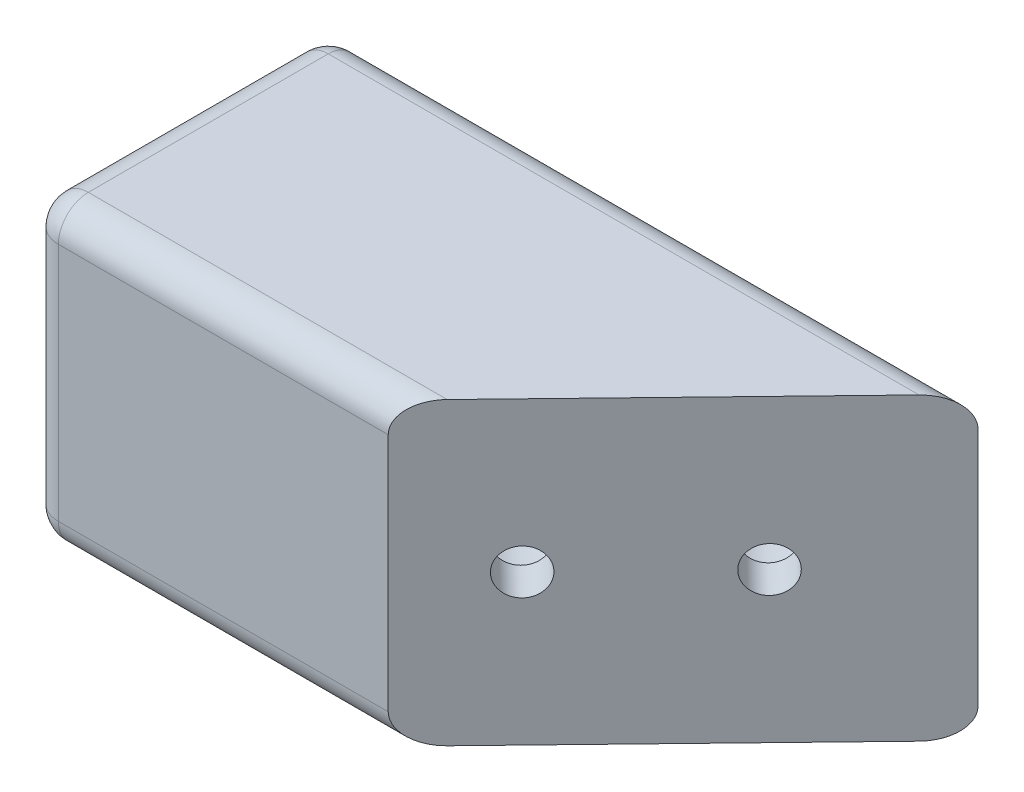
from build123d import *

# Parameters (mm, degrees)
BOSS_EXTRUDE1_DEPTH = 30
SKETCH2_R           = 2.25
CUT_EXTRUDE1_DEPTH  = 57.77507973
SKETCH3_R           = 5
CUT_EXTRUDE2_DEPTH  = 54.530698882
FILLET1_R           = 3


with BuildPart() as part:
    # Sketch1 → Boss-Extrude1 (new body)
    with BuildSketch(Plane(origin=(0, 0, 0), x_dir=(1, 0, 0), z_dir=(0, 1, 0))):
        Polygon((3.5, -15), (32.5, 15), (-32.5, 15), (-32.5, -15), align=None)
    extrude(amount=BOSS_EXTRUDE1_DEPTH)

    # Sketch2 → Cut-Extrude1 (cut, through all)
    with BuildSketch(Plane(origin=(9.304997128, 0, 8.994830557), x_dir=(0.6950220968474751, 0, -0.7189883760491118), z_dir=(0.7189883760491118, 0, 0.6950220968474751))):
        with Locations((18.623043788, 15)):
            Circle(SKETCH2_R)
        with Locations((1.123043788, 15)):
            Circle(SKETCH2_R)
    extrude(amount=-CUT_EXTRUDE1_DEPTH, mode=Mode.SUBTRACT)

    # Sketch3 → Cut-Extrude2 (cut, through all)
    with BuildSketch(Plane(origin=(6.429043624, 0, 6.21474217), x_dir=(0.6950220968474751, 0, -0.7189883760491118), z_dir=(0.7189883760491118, 0, 0.6950220968474751))):
        with Locations((18.623043788, 15)):
            Circle(SKETCH3_R)
        with Locations((1.123043788, 15)):
            Circle(SKETCH3_R)
    extrude(amount=-CUT_EXTRUDE2_DEPTH, mode=Mode.SUBTRACT)

    # Fillet1
    fillet1_edges = [part.edges().sort_by_distance(p)[0] for p in [
        (-14.5, 30, 15),
        (0, 30, -15),
        (-14.5, 0, 15),
        (-32.5, 0, 0),
        (0, 0, -15),
        (-32.5, 30, 0),
        (-32.5, 15, 15),
        (-32.5, 15, -15),
    ]]
    fillet(fillet1_edges, radius=FILLET1_R)


solid = part.part
